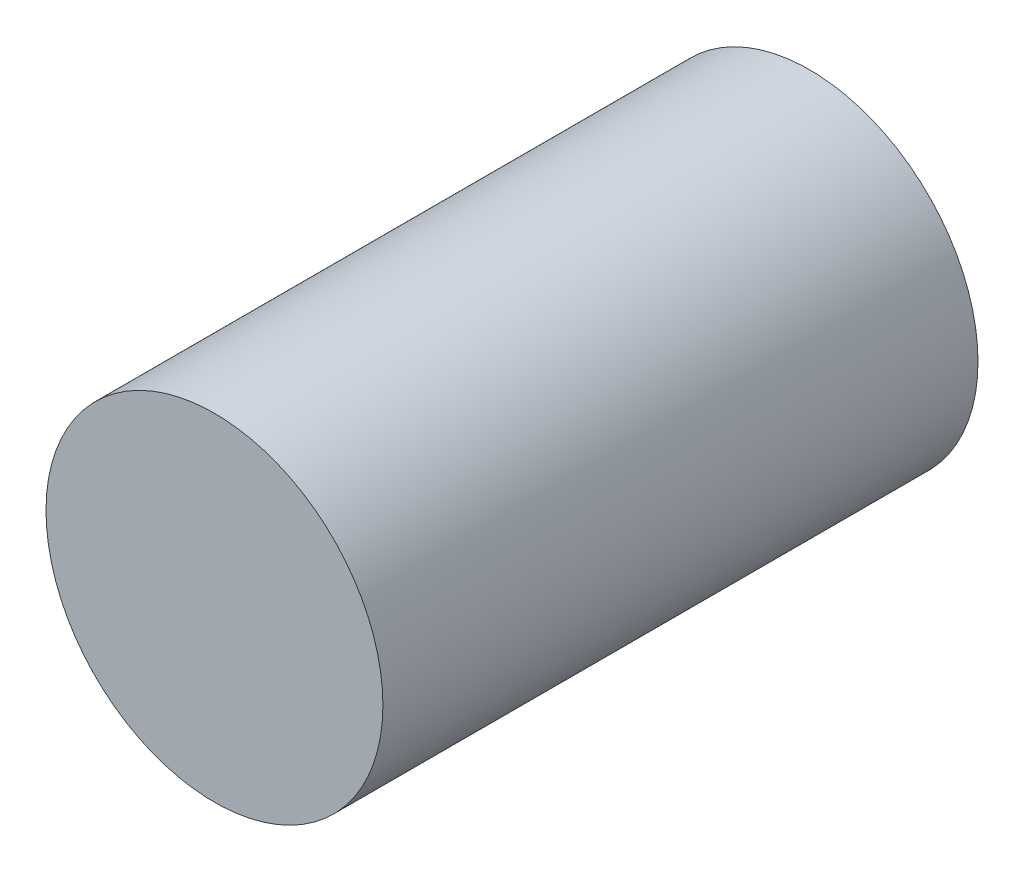
from build123d import *

# Parameters (mm, degrees)
SKETCH1_R           = 13.5
BOSS_EXTRUDE1_DEPTH = 47.69


with BuildPart() as part:
    # Sketch1 → Boss-Extrude1 (new body)
    with BuildSketch(Plane.XY):
        with Locations(Location((0, 0, 0), (0, 0, 180))):
            Circle(SKETCH1_R)
    extrude(amount=BOSS_EXTRUDE1_DEPTH)


solid = part.part
